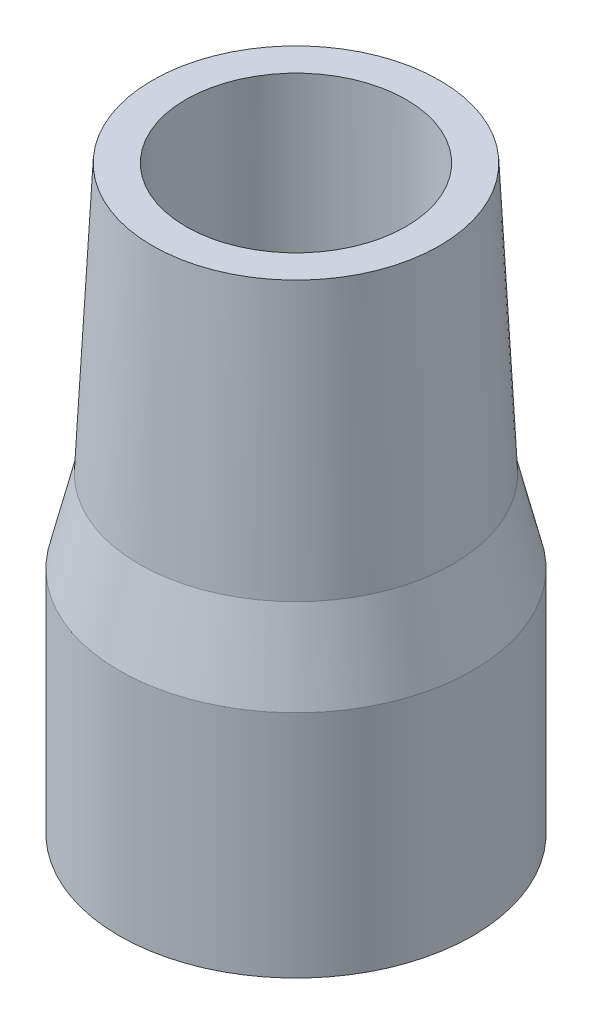
from build123d import *


with BuildPart() as part:
    # Sketch1 → Revolve1 (revolve)
    with BuildSketch(Plane.XY, mode=Mode.PRIVATE) as revolve1_sk:
        Polygon((9.8, 3.281137882), (10.25, -16.718862118), (13.25, -16.718862118), (13.25, 0.499962164), (11.75, 6.646562602), (10.75, 26.808621535), (8.25, 26.808621535), (8.293147517, 6.808621535), (8.293147517, 3.808621535), (9.8, 3.808621535), align=None)
    revolve(revolve1_sk.sketch.rotate(Axis((0, 0, 0), (0, 1, 0)), 90), axis=Axis((0, 0, 0), (0, 1, 0)))


solid = part.part
